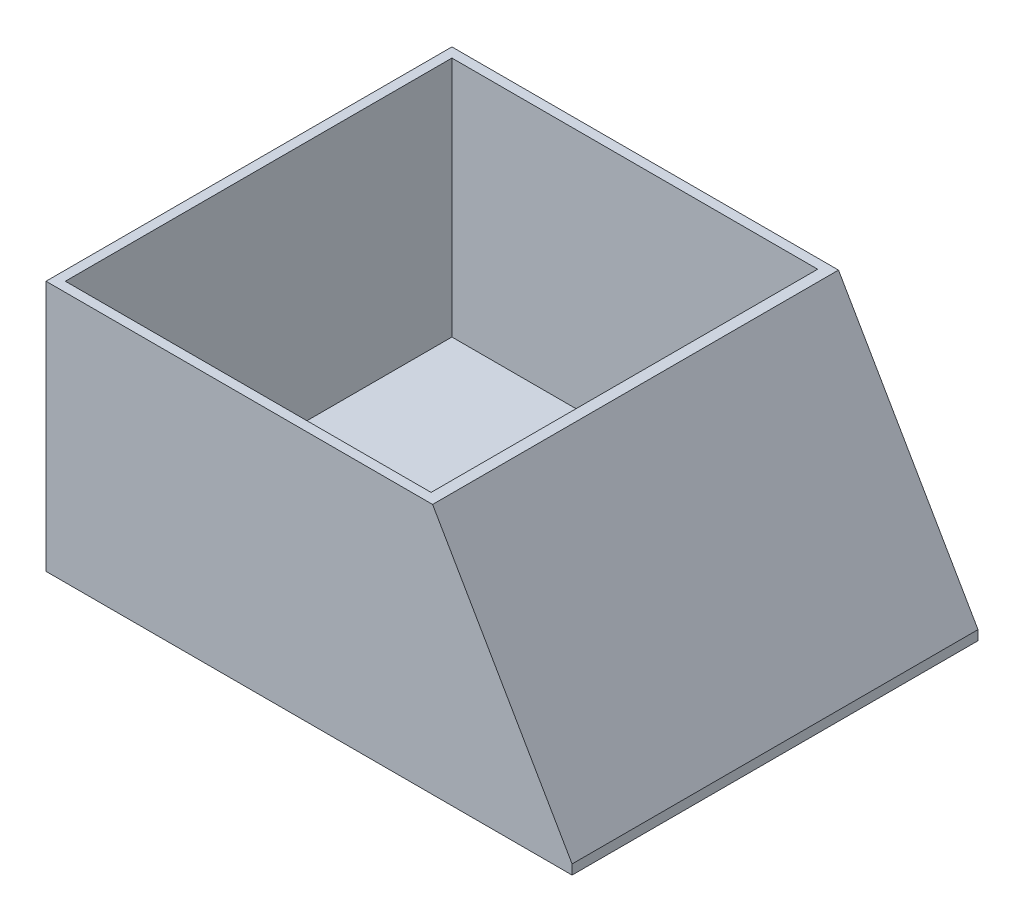
from build123d import *

# Parameters (mm, degrees)
SKETCH2_W           = 3
SKETCH2_H           = 75
SKETCH2_W_2         = 163.301270189
SKETCH2_H_2         = 3
BOSS_EXTRUDE3_DEPTH = 60
BOSS_EXTRUDE4_START = 60
SKETCH2_3_W         = 163.301270189
SKETCH2_3_H         = 3
SKETCH2_3_W_2       = 3
SKETCH2_3_H_2       = 75
BOSS_EXTRUDE4_DEPTH = 3


with BuildPart() as part:
    # Sketch2 → Boss-Extrude3 (new body)
    with BuildSketch(Plane.XY):
        with Locations((-1.5, 37.5)):
            Rectangle(SKETCH2_W, SKETCH2_H)
        Polygon((156.837168574, 0), (160.301270189, 0), (117, 75), (113.535898385, 75), align=None)
        with Locations((78.650635095, -1.5)):
            Rectangle(SKETCH2_W_2, SKETCH2_H_2)
    extrude(amount=BOSS_EXTRUDE3_DEPTH)

    # Sketch2<3> → Boss-Extrude4 (add)
    with BuildSketch(Plane.XY.offset(BOSS_EXTRUDE4_START)):
        Polygon((156.837168574, 0), (160.301270189, 0), (117, 75), (113.535898385, 75), align=None)
        with Locations((78.650635095, -1.5)):
            Rectangle(SKETCH2_3_W, SKETCH2_3_H)
        Polygon((0, 0), (156.837168574, 0), (113.535898385, 75), (0, 75), align=None)
        with Locations((-1.5, 37.5)):
            Rectangle(SKETCH2_3_W_2, SKETCH2_3_H_2)
    extrude(amount=BOSS_EXTRUDE4_DEPTH)

    # Mirror2: part across plane


with BuildPart() as part_1:
    add(part.part)
    add(part.part.mirror(Plane.XY))


solid = part_1.part
